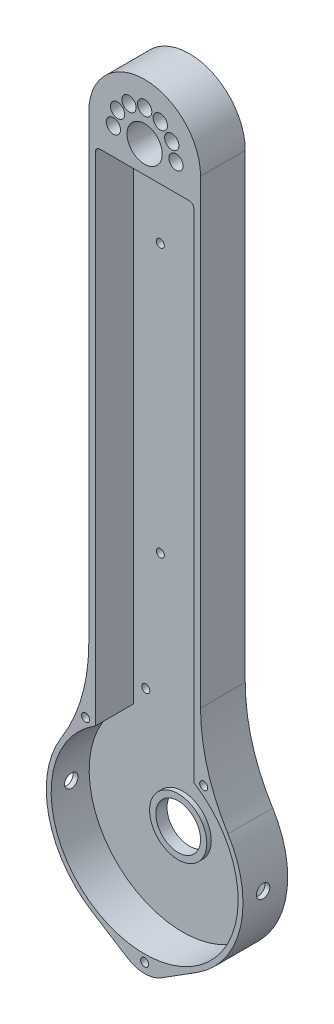
from build123d import *

# Parameters (mm, degrees)
BOSS_EXTRUDE1_DEPTH      = 12.7
SKETCH2_R                = 5
CUT_EXTRUDE1_DEPTH       = 33
SKETCH3_R                = 2.032
CUT_EXTRUDE2_DEPTH       = 7.62
CUT_EXTRUDE3_DEPTH       = 10.795
SKETCH5_R                = 1.5875
CUT_EXTRUDE4_DEPTH       = 10
SKETCH6_W                = 3.175
SKETCH6_H                = 11.169050429
CUT_EXTRUDE5_DEPTH       = 0.635
SKETCH7_R                = 6
CUT_EXTRUDE6_DEPTH       = 1.5494
SKETCH9_R                = 8.128
BOSS_EXTRUDE2_DEPTH      = 1.27
SKETCH10_R               = 6.35
CUT_EXTRUDE7_DEPTH       = 22.27
SKETCH11_R               = 1.143
CUT_EXTRUDE8_DEPTH       = 49.276
SKETCH12_R               = 1.143
CUT_EXTRUDE9_DEPTH       = 49.276
SKETCH13_R               = 1.143
CUT_EXTRUDE10_DEPTH      = 49.276
CUT_EXTRUDE11_DEPTH      = 50.8
CUT_EXTRUDE11_DEPTH_BACK = 50.8
SKETCH15_R               = 1.905


with BuildPart() as part:
    # Sketch1 → Boss-Extrude1 (new body)
    with BuildSketch(Plane.XY):
        with BuildLine():
            Line((-15.875, 246.311767937), (-15.875, 115.477708001))
            ThreePointArc((-15.875, 115.477708001), (-17.859739298, 101.416757728), (-23.658870968, 88.454520863))
            ThreePointArc((-23.658870968, 88.454520863), (-27.242596913, 67.388179182), (-14.890892485, 49.950597894))
            Line((-14.890892485, 49.950597894), (-4.737825133, 43.555823885))
            ThreePointArc((-4.737825133, 43.555823885), (0, 42.188131575), (4.737825135, 43.555823883))
            Line((4.737825135, 43.555823883), (14.890307558, 49.950229476))
            ThreePointArc((14.890307558, 49.950229476), (27.242520167, 67.387842169), (23.658870968, 88.454520863))
            ThreePointArc((23.658870968, 88.454520863), (17.859739298, 101.416757728), (15.875, 115.477708001))
            Line((15.875, 115.477708001), (15.875, 246.311767937))
            ThreePointArc((15.875, 246.311767937), (0, 262.186767937), (-15.875, 246.311767937))
        make_face()
    extrude(amount=BOSS_EXTRUDE1_DEPTH)

    # Sketch2 → Cut-Extrude1 (cut)
    with BuildSketch(Plane.XY.offset(12.7)):
        with Locations((0, 246.311767937)):
            Circle(SKETCH2_R)
    extrude(amount=-CUT_EXTRUDE1_DEPTH, mode=Mode.SUBTRACT)

    # Sketch3 → Cut-Extrude2 (cut)
    with BuildSketch(Plane.XY.offset(12.7)):
        with Locations((-8.89, 246.311767937)):
            Circle(SKETCH3_R)
        with Locations((-7.697390963, 250.754770656)):
            Circle(SKETCH3_R)
        with Locations((-4.443636151, 254.006796041)):
            Circle(SKETCH3_R)
        with Locations((0, 255.197042749)):
            Circle(SKETCH3_R)
        with Locations((4.443636151, 254.006796041)):
            Circle(SKETCH3_R)
        with Locations((7.697390963, 250.754770656)):
            Circle(SKETCH3_R)
        with Locations((8.89, 246.311767937)):
            Circle(SKETCH3_R)
    extrude(amount=-CUT_EXTRUDE2_DEPTH, mode=Mode.SUBTRACT)

    # Sketch4 → Cut-Extrude3 (cut)
    with BuildSketch(Plane.XY.offset(12.7)):
        with BuildLine():
            Line((-12.7, 238.691767937), (12.7, 238.691767937))
            ThreePointArc((12.7, 238.691767937), (13.598025612, 238.319793549), (13.97, 237.421767937))
            Line((13.97, 237.421767937), (13.97, 96.175375416))
            ThreePointArc((13.97, 96.175375416), (0, 47.036538193), (-13.97, 96.175375416))
            Line((-13.97, 96.175375416), (-13.97, 237.421767937))
            ThreePointArc((-13.97, 237.421767937), (-13.598025612, 238.319793549), (-12.7, 238.691767937))
        make_face()
    extrude(amount=-CUT_EXTRUDE3_DEPTH, mode=Mode.SUBTRACT)

    # Sketch5 → Cut-Extrude4 (cut)
    with BuildSketch(Plane.XY.offset(1.905)):
        with Locations((0, 235.311767937)):
            Circle(SKETCH5_R)
    extrude(amount=-CUT_EXTRUDE4_DEPTH, mode=Mode.SUBTRACT)

    # Sketch6 → Cut-Extrude5 (cut)
    with BuildSketch(Plane(origin=(0, 0, 0), x_dir=(-1, 0, 0), z_dir=(0, 0, -1))):
        with Locations((0, 240.896293152)):
            Rectangle(SKETCH6_W, SKETCH6_H)
    extrude(amount=-CUT_EXTRUDE5_DEPTH, mode=Mode.SUBTRACT)

    # Sketch7 → Cut-Extrude6 (cut)
    with BuildSketch(Plane(origin=(0, 0, 0), x_dir=(-1, 0, 0), z_dir=(0, 0, -1))):
        with Locations((0, 246.311767937)):
            Circle(SKETCH7_R)
    extrude(amount=-CUT_EXTRUDE6_DEPTH, mode=Mode.SUBTRACT)

    # Sketch9 → Boss-Extrude2 (add)
    with BuildSketch(Plane.XY.offset(1.905)):
        with Locations((0, 73.591767937)):
            Circle(SKETCH9_R)
    extrude(amount=BOSS_EXTRUDE2_DEPTH)

    # Sketch10 → Cut-Extrude7 (cut)
    with BuildSketch(Plane.XY.offset(3.175)):
        with Locations((0, 73.591767937)):
            Circle(SKETCH10_R)
    extrude(amount=-CUT_EXTRUDE7_DEPTH, mode=Mode.SUBTRACT)

    # Sketch11 → Cut-Extrude8 (cut)
    with BuildSketch(Plane.XY.offset(1.905)):
        with Locations((-10.4775, 101.709567937)):
            Circle(SKETCH11_R)
        with Locations((10.4775, 101.709567937)):
            Circle(SKETCH11_R)
    extrude(amount=-CUT_EXTRUDE8_DEPTH, mode=Mode.SUBTRACT)

    # Sketch12 → Cut-Extrude9 (cut)
    with BuildSketch(Plane.XY.offset(12.7)):
        with Locations((-16.764, 96.832767937)):
            Circle(SKETCH12_R)
        with Locations((16.764, 96.832767937)):
            Circle(SKETCH12_R)
        with Locations((0, 45.016767937)):
            Circle(SKETCH12_R)
    extrude(amount=-CUT_EXTRUDE9_DEPTH, mode=Mode.SUBTRACT)

    # Sketch13 → Cut-Extrude10 (cut)
    with BuildSketch(Plane.XY.offset(1.905)):
        with Locations((-6.35, 213.291767937)):
            Circle(SKETCH13_R)
        with Locations((6.35, 213.291767937)):
            Circle(SKETCH13_R)
        with Locations((-6.35, 137.091767937)):
            Circle(SKETCH13_R)
        with Locations((6.35, 137.091767937)):
            Circle(SKETCH13_R)
    extrude(amount=-CUT_EXTRUDE10_DEPTH, mode=Mode.SUBTRACT)

    # Sketch15 → Cut-Extrude11 (cut, two sides: drawn at the far end of the back side and taken through both)
    with BuildSketch(Plane.ZY.offset(-CUT_EXTRUDE11_DEPTH_BACK)):
        with Locations(Location((6.985, 73.591767937, 0), (0, 0, 90))):
            Circle(SKETCH15_R)
    extrude(amount=CUT_EXTRUDE11_DEPTH + CUT_EXTRUDE11_DEPTH_BACK, mode=Mode.SUBTRACT)


solid = part.part
